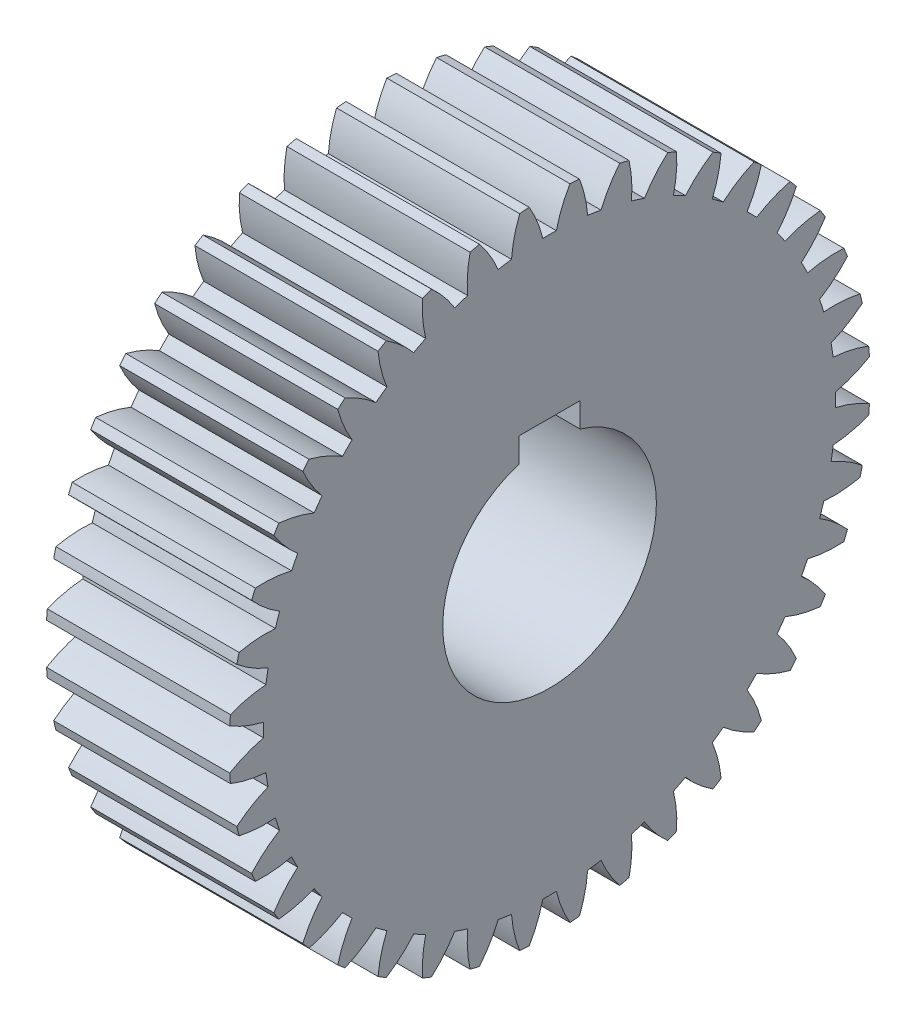
from build123d import *

# Parameters (mm, degrees)
BASPROSKE_W     = 30
BASPROSKE_H     = 52.5
TOOTHCUT_DEPTH  = 81.07808689
TEETHCUTS_COUNT = 40
TEETHCUTS_ANGLE = 351
BORSKE_R        = 17.5
BORE_DEPTH      = 50.0000508
KEYSKE_W        = 10
KEYSKE_H        = 20.8
KEYWAY_DEPTH    = 50.0000508


with BuildPart() as part:
    # BasProSke → Base-Revolve (revolve)
    with BuildSketch(Plane(origin=(0, 0, 0), x_dir=(1, 0, 0), z_dir=(0, 1, 0)), mode=Mode.PRIVATE) as base_revolve_sk:
        with Locations((15, 26.25)):
            Rectangle(BASPROSKE_W, BASPROSKE_H)
    revolve(base_revolve_sk.sketch.rotate(Axis((-10, 0, 0), (1, 0, 0)), 180), axis=Axis((-10, 0, 0), (1, 0, 0)))

    # TooCutSke → ToothCut (cut, through all)
    with BuildSketch(Plane(origin=(0, 0, 0), x_dir=(0, 0, -1), z_dir=(1, 0, 0))):
        with BuildLine():
            ThreePointArc((1.108908031, 46.86088133), (0, 46.874), (-1.108908031, 46.86088133))
            ThreePointArc((-1.108908031, 46.86088133), (-2.020311534, 49.724086633), (-3.350376445, 52.418437814))
            ThreePointArc((-3.350376445, 52.418437814), (0, 52.5254), (3.350376445, 52.418437814))
            ThreePointArc((3.350376445, 52.418437814), (2.020311534, 49.724086633), (1.108908031, 46.86088133))
        make_face()
    toothcut = extrude(amount=TOOTHCUT_DEPTH, mode=Mode.SUBTRACT)

    # TeethCuts: ToothCut ×40 about axis
    teethcuts_axis = Axis((-10, 0, 0), (1, 0, 0))
    for i in range(1, TEETHCUTS_COUNT):
        add(toothcut.rotate(teethcuts_axis, i * TEETHCUTS_ANGLE / (TEETHCUTS_COUNT - 1)), mode=Mode.SUBTRACT)

    # BorSke → Bore (cut, symmetric)
    with BuildSketch(Plane(origin=(0, 0, 0), x_dir=(0, 0, -1), z_dir=(1, 0, 0))):
        with Locations(Location((0, 0, 0), (0, 0, 180))):
            Circle(BORSKE_R)
    extrude(amount=BORE_DEPTH, both=True, mode=Mode.SUBTRACT)

    # KeySke → Keyway (cut, symmetric)
    with BuildSketch(Plane(origin=(0, 0, 0), x_dir=(0, 0, -1), z_dir=(1, 0, 0))):
        with Locations((0, 10.4)):
            Rectangle(KEYSKE_W, KEYSKE_H)
    extrude(amount=KEYWAY_DEPTH, both=True, mode=Mode.SUBTRACT)


solid = part.part
